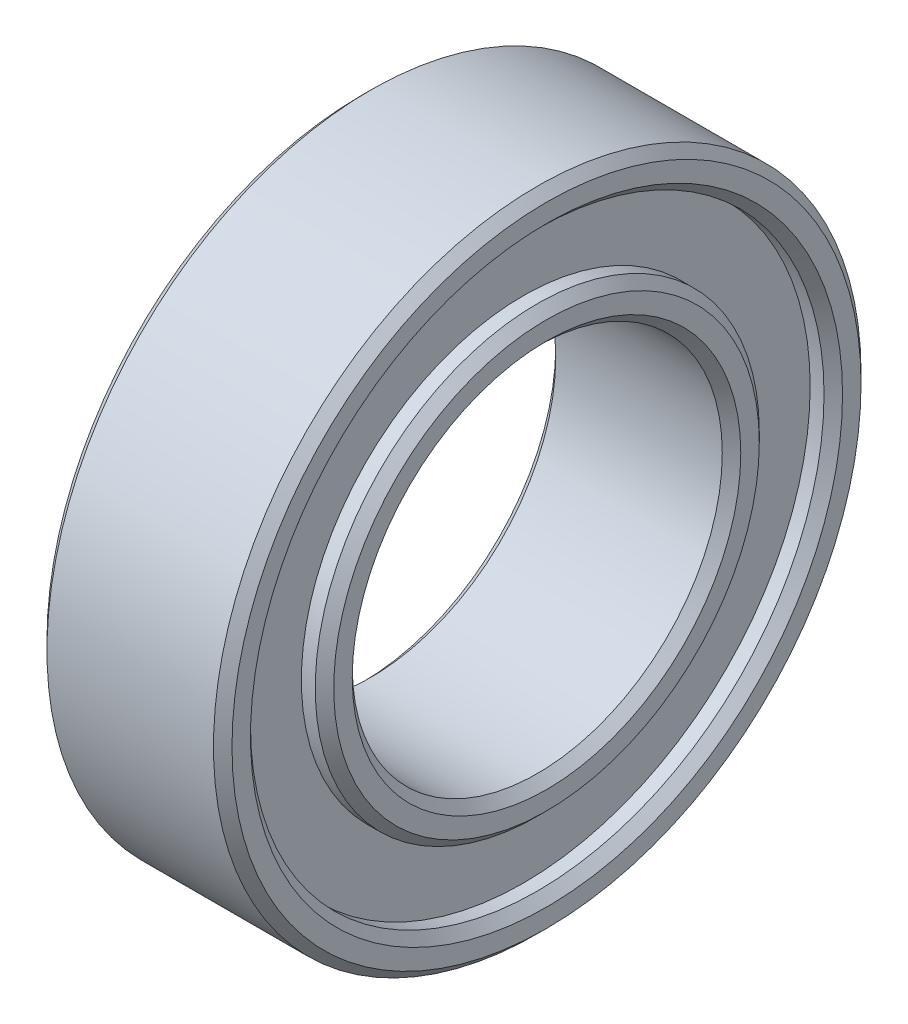
from build123d import *

# Parameters (mm, degrees)
SKETCH1_R           = 7
SKETCH1_R_2         = 4
BOSS_EXTRUDE1_DEPTH = 2
SKETCH2_R           = 6.2
SKETCH2_R_2         = 4.8
CUT_EXTRUDE1_DEPTH  = 0.5
CHAMFER1_SIZE       = 0.2


with BuildPart() as part:
    # Sketch1 → Boss-Extrude1 (new, symmetric)
    with BuildSketch(Plane(origin=(0, 0, 0), x_dir=(0, 0, -1), z_dir=(1, 0, 0))):
        Circle(SKETCH1_R)
        Circle(SKETCH1_R_2, mode=Mode.SUBTRACT)
    extrude(amount=BOSS_EXTRUDE1_DEPTH, both=True)

    # Sketch2 → Cut-Extrude1 (cut)
    with BuildSketch(Plane(origin=(2, 0, 0), x_dir=(0, 0, -1), z_dir=(1, 0, 0))):
        Circle(SKETCH2_R)
        Circle(SKETCH2_R_2, mode=Mode.SUBTRACT)
    cut_extrude1 = extrude(amount=-CUT_EXTRUDE1_DEPTH, mode=Mode.SUBTRACT)

    # Mirror1: Cut-Extrude1 across plane
    add(cut_extrude1.mirror(Plane(origin=(0, 0, 0), x_dir=(0, 0, 1), z_dir=(1, 0, 0))), mode=Mode.SUBTRACT)

    # Chamfer1
    chamfer1_edges = [part.edges().sort_by_distance(p)[0] for p in [
        (2, 0, 6.2),
        (2, 0, 4.8),
        (-2, 0, 4.8),
        (-2, 0, 6.2),
        (-2, 0, 7),
        (2, 0, 7),
        (-2, 0, 4),
        (2, 0, 4),
    ]]
    chamfer(chamfer1_edges, length=CHAMFER1_SIZE)


solid = part.part
